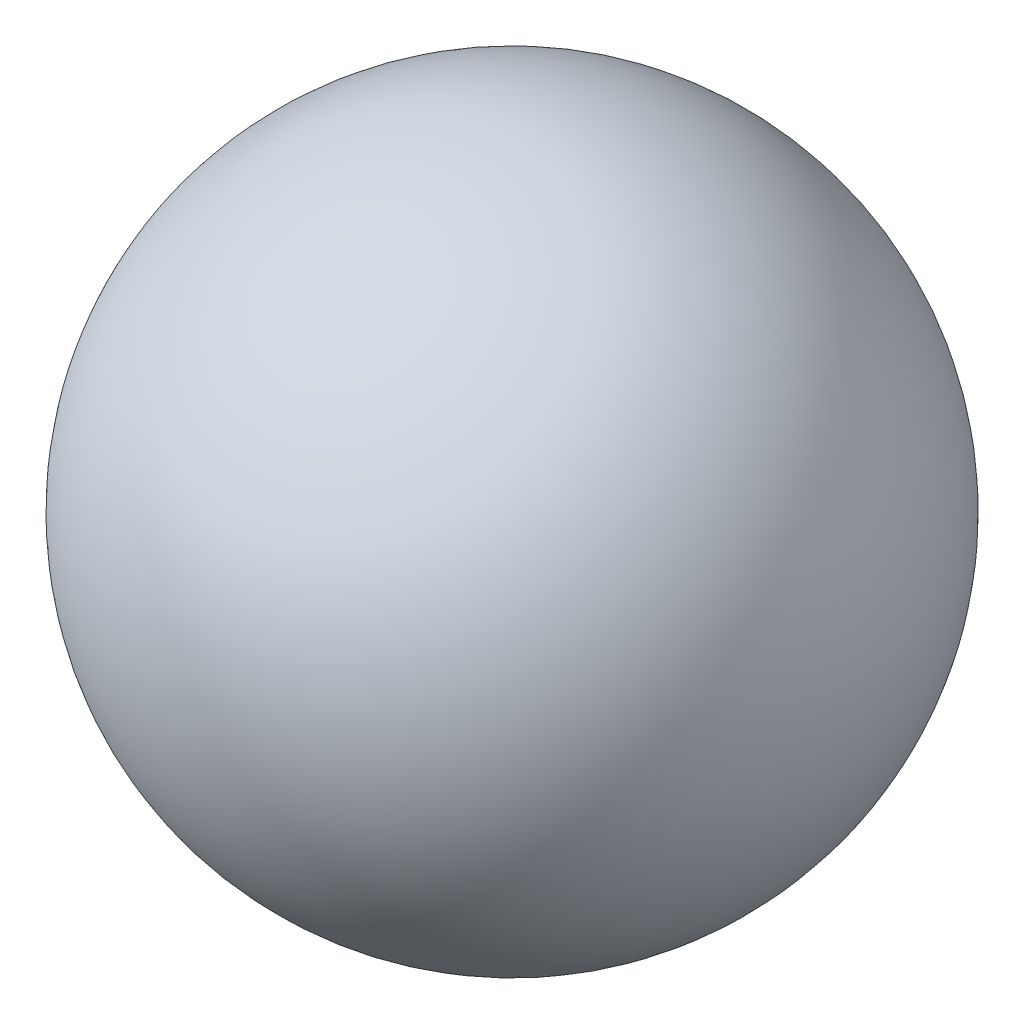
from build123d import *


with BuildPart() as part:
    # Эскиз1 → Повернуть1 (revolve)
    with BuildSketch(Plane.XY):
        with BuildLine():
            Line((1.710719086, 19.141442232), (-1.710719086, 19.141442232))
            ThreePointArc((-1.710719086, 19.141442232), (0, 20.852161318), (1.710719086, 19.141442232))
        make_face()
    revolve(axis=Axis((3.687675502, 19.141442232, 0), (-1, 0, 0)))


solid = part.part
